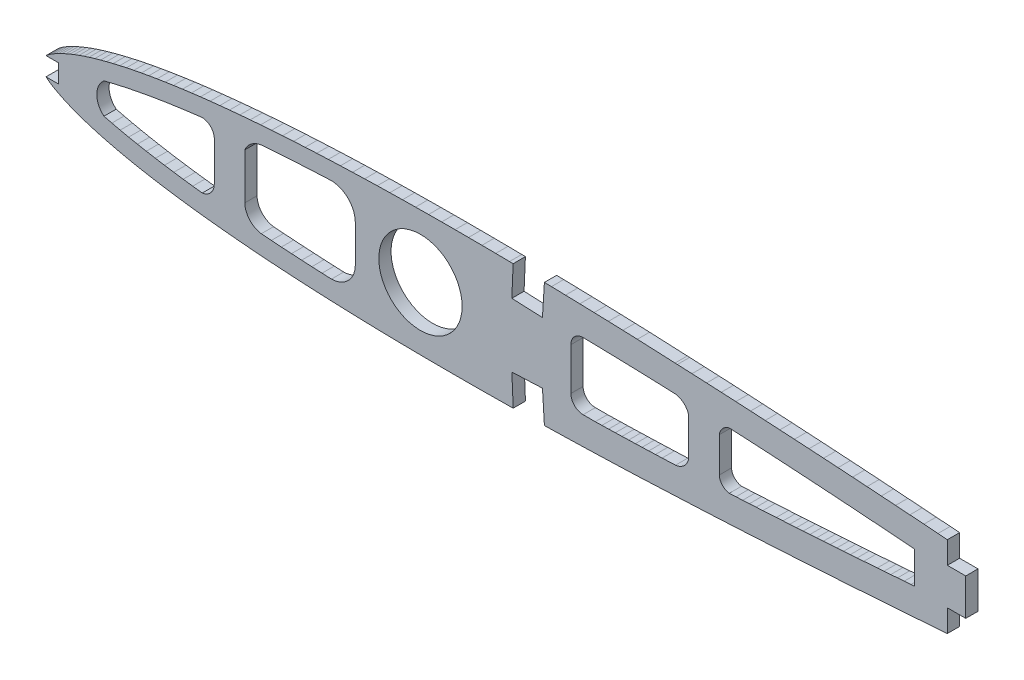
from build123d import *

# Parameters (mm, degrees)
MODEL_R         = 6.794297368
EXTRUDE_1_DEPTH = 2


with BuildPart() as part:
    # Model → 凸台-拉伸1 (new body)
    with BuildSketch(Plane.XY):
        Polygon((-3.904928875, 19.257136271), (-1.898266713, 19.257136271), (-1.898266713, 22.257136271), (-3.904609086, 22.257136271), (-3.641266713, 22.474136271), (-3.265266713, 22.748136271), (-2.876266713, 23.003136271), (-2.365266713, 23.302136271), (-1.843266713, 23.579136271), (-1.312266713, 23.838136271), (-0.652266713, 24.141136271), (0.013733287, 24.427136271), (0.687733287, 24.696136271), (1.489733287, 24.995136271), (2.299733287, 25.274136271), (3.115733287, 25.536136271), (4.060733287, 25.820136271), (5.010733287, 26.086136271), (5.964733287, 26.338136271), (7.045733287, 26.606136271), (8.130733287, 26.859136271), (9.219733287, 27.098136271), (10.433733287, 27.348136271), (11.649733287, 27.582136271), (12.869733287, 27.803136271), (14.210733287, 28.032136271), (15.552733287, 28.247136271), (16.898733287, 28.449136271), (18.361733287, 28.655136271), (19.825733287, 28.848136271), (21.292733287, 29.029136271), (22.872733287, 29.210136271), (24.452733287, 29.380136271), (26.035733287, 29.538136271), (27.724733287, 29.695136271), (29.413733287, 29.841136271), (31.104733287, 29.976136271), (32.896733287, 30.108136271), (34.689733287, 30.229136271), (36.482733287, 30.339136271), (38.370733287, 30.444136271), (40.258733287, 30.539136271), (42.148733287, 30.624136271), (44.124733287, 30.704136271), (46.101733287, 30.774136271), (48.078733287, 30.834136271), (50.135733287, 30.888136271), (52.191733287, 30.933136271), (54.248733287, 30.969136271), (56.378733287, 30.997136271), (58.507733287, 31.017136271), (60.637733287, 31.028136271), (62.831733287, 31.032136271), (65.024733287, 31.028136271), (67.217733287, 31.017136271), (69.466733287, 30.998136271), (71.714733287, 30.971136271), (72.306854961, 30.962184676), (72.087733287, 25.959136271), (77.083733287, 25.741136271), (77.405733287, 30.870636271), (78.552733287, 30.846136271), (80.847733287, 30.791136271), (83.180733287, 30.729136271), (85.512733287, 30.660136271), (87.845733287, 30.586136271), (90.206733287, 30.504136271), (92.566733287, 30.416136271), (98.716780529, 30.134573654), (99.098691617, 30.117885102), (101.478691617, 30.007885102), (103.867691617, 29.892885102), (106.255691617, 29.771885102), (108.643691617, 29.644885102), (111.032691617, 29.512885102), (113.420691617, 29.375885102), (115.808691617, 29.236885102), (118.189691617, 29.095885102), (120.568691617, 28.951885102), (122.948691617, 28.802885102), (125.309691617, 28.650885102), (127.668691617, 28.493885102), (130.029691617, 28.332885102), (132.362691617, 28.170885102), (134.694691617, 28.006885102), (137.027691617, 27.839885102), (139.322691617, 27.671885102), (141.617691617, 27.500885102), (143.143747168, 27.384468484), (143.143747168, 23.764986482), (146.143747168, 23.764986482), (146.143747168, 17.764986482), (143.143747168, 17.764986482), (143.143747168, 14.124636482), (141.617691617, 14.008885102), (139.322691617, 13.837885102), (137.027691617, 13.669885102), (134.694691617, 13.501885102), (132.362691617, 13.337885102), (130.029691617, 13.175885102), (127.668691617, 13.015885102), (125.309691617, 12.858885102), (122.948691617, 12.705885102), (120.568691617, 12.557885102), (118.189691617, 12.413885102), (115.808691617, 12.272885102), (113.420691617, 12.132885102), (111.032691617, 11.995885102), (108.643691617, 11.863885102), (106.255691617, 11.736885102), (103.867691617, 11.615885102), (101.478691617, 11.500885102), (99.098691617, 11.391885102), (98.716930448, 11.375042697), (92.566733287, 11.097136271), (90.206733287, 11.010136271), (87.845733287, 10.928136271), (85.512733287, 10.853136271), (83.180733287, 10.785136271), (80.847733287, 10.722136271), (78.552733287, 10.667136271), (77.405733287, 10.642636271), (77.093361812, 15.763094608), (72.098361812, 15.545094608), (72.316268626, 10.55123018), (71.714733287, 10.542136271), (69.466733287, 10.516136271), (67.217733287, 10.496136271), (65.024733287, 10.485136271), (62.831733287, 10.481136271), (60.637733287, 10.485136271), (58.507733287, 10.497136271), (56.378733287, 10.516136271), (54.248733287, 10.544136271), (52.191733287, 10.580136271), (50.135733287, 10.625136271), (48.078733287, 10.679136271), (46.101733287, 10.740136271), (44.124733287, 10.810136271), (42.148733287, 10.889136271), (40.258733287, 10.974136271), (38.370733287, 11.069136271), (36.482733287, 11.174136271), (34.689733287, 11.285136271), (32.896733287, 11.405136271), (31.104733287, 11.537136271), (29.413733287, 11.672136271), (27.724733287, 11.818136271), (26.035733287, 11.976136271), (24.452733287, 12.134136271), (22.872733287, 12.303136271), (21.292733287, 12.485136271), (19.825733287, 12.665136271), (18.361733287, 12.858136271), (16.898733287, 13.064136271), (15.552733287, 13.267136271), (14.210733287, 13.482136271), (12.869733287, 13.710136271), (11.649733287, 13.931136271), (10.433733287, 14.166136271), (9.219733287, 14.416136271), (8.130733287, 14.654136271), (7.045733287, 14.907136271), (5.964733287, 15.176136271), (5.010733287, 15.427136271), (4.060733287, 15.693136271), (3.115733287, 15.977136271), (2.299733287, 16.239136271), (1.489733287, 16.518136271), (0.687733287, 16.817136271), (0.013733287, 17.087136271), (-0.652266713, 17.373136271), (-1.312266713, 17.675136271), (-1.843266713, 17.935136271), (-2.365266713, 18.211136271), (-2.876266713, 18.511136271), (-3.265266713, 18.765136271), (-3.641266713, 19.039136271), align=None)
        with Locations((57.184251323, 20.757136271)):
            Circle(MODEL_R, mode=Mode.SUBTRACT)
        with BuildLine():
            Line((5.548721123, 23.412080622), (6.840615117, 23.735054121))
            Line((6.840615117, 23.735054121), (8.203563977, 24.049919528))
            Line((8.203563977, 24.049919528), (9.580468827, 24.347029431))
            Line((9.580468827, 24.347029431), (11.008725704, 24.632680807))
            Line((11.008725704, 24.632680807), (12.454759931, 24.902967578))
            Line((12.454759931, 24.902967578), (13.934870343, 25.162438153))
            Line((13.934870343, 25.162438153), (15.419157195, 25.403803948))
            Line((15.419157195, 25.403803948), (16.940964656, 25.633553655))
            Line((16.940964656, 25.633553655), (18.472927795, 25.850772309))
            Line((18.472927795, 25.850772309), (20.02662113, 26.056711042))
            Line((20.02662113, 26.056711042), (21.584312521, 26.249131744))
            ThreePointArc((21.584312521, 26.249131744), (23.008577337, 25.607158467), (23.548379113, 24.141118223))
            Line((23.548379113, 24.141118223), (23.548379113, 17.882100159))
            ThreePointArc((23.548379113, 17.882100159), (23.001354723, 16.360643911), (21.584312521, 15.582147797))
            Line((21.584312521, 15.582147797), (20.02662113, 15.774568498))
            Line((20.02662113, 15.774568498), (18.472927795, 15.980507232))
            Line((18.472927795, 15.980507232), (16.940964656, 16.197725886))
            Line((16.940964656, 16.197725886), (15.419157195, 16.427475592))
            Line((15.419157195, 16.427475592), (13.934870343, 16.668841388))
            Line((13.934870343, 16.668841388), (12.454759931, 16.928311963))
            Line((12.454759931, 16.928311963), (11.008725704, 17.198598734))
            Line((11.008725704, 17.198598734), (9.580468827, 17.48425011))
            Line((9.580468827, 17.48425011), (8.203563977, 17.781360013))
            Line((8.203563977, 17.781360013), (6.840615117, 18.09622542))
            Line((6.840615117, 18.09622542), (5.548721123, 18.419198918))
            ThreePointArc((5.548721123, 18.419198918), (4.383350459, 20.91563977), (5.548721123, 23.412080622))
        make_face(mode=Mode.SUBTRACT)
        with BuildLine():
            Line((31.213289067, 27.184719881), (32.854840919, 27.308127325))
            Line((32.854840919, 27.308127325), (34.491785611, 27.421900786))
            Line((34.491785611, 27.421900786), (36.14288999, 27.526695845))
            Line((36.14288999, 27.526695845), (37.80205053, 27.62484337))
            Line((37.80205053, 27.62484337), (39.461205149, 27.715724031))
            Line((39.461205149, 27.715724031), (41.127710475, 27.797530042))
            Line((41.127710475, 27.797530042), (42.660857543, 27.868290676))
            ThreePointArc((42.660857543, 27.868290676), (45.419538492, 26.682795274), (46.556398714, 23.903718312))
            Line((46.556398714, 23.903718312), (46.556398714, 17.927561228))
            ThreePointArc((46.556398714, 17.927561228), (45.419538492, 15.148484267), (42.660857543, 13.962988864))
            Line((42.660857543, 13.962988864), (41.127710475, 14.033749498))
            Line((41.127710475, 14.033749498), (39.461205149, 14.11555551))
            Line((39.461205149, 14.11555551), (37.80205053, 14.20643617))
            Line((37.80205053, 14.20643617), (36.14288999, 14.304583695))
            Line((36.14288999, 14.304583695), (34.491785611, 14.409378755))
            Line((34.491785611, 14.409378755), (32.854840919, 14.523152215))
            Line((32.854840919, 14.523152215), (31.213289067, 14.64655966))
            ThreePointArc((31.213289067, 14.64655966), (29.313385312, 15.66170282), (28.524280387, 17.666063899))
            Line((28.524280387, 17.666063899), (28.524280387, 25.153588954))
            ThreePointArc((28.524280387, 25.153588954), (29.602139204, 26.522165697), (31.213289067, 27.184719881))
        make_face(mode=Mode.SUBTRACT)
        with BuildLine():
            Line((137.761539545, 23.390840064), (137.209687212, 23.434028501))
            Line((137.209687212, 23.434028501), (136.112253522, 23.518812167))
            Line((136.112253522, 23.518812167), (135.013229103, 23.602524582))
            Line((135.013229103, 23.602524582), (133.910429103, 23.685324582))
            Line((133.910429103, 23.685324582), (132.809517357, 23.769180754))
            Line((132.809517357, 23.769180754), (131.712383033, 23.850361531))
            Line((131.712383033, 23.850361531), (130.611472045, 23.930623812))
            Line((130.611472045, 23.930623812), (129.510425513, 24.010895975))
            Line((129.510425513, 24.010895975), (128.412604702, 24.089824268))
            Line((128.412604702, 24.089824268), (127.311830464, 24.167680988))
            Line((127.311830464, 24.167680988), (126.213747532, 24.245431948))
            Line((126.213747532, 24.245431948), (125.115932824, 24.320772173))
            Line((125.115932824, 24.320772173), (124.015155669, 24.396233492))
            Line((124.015155669, 24.396233492), (122.91721259, 24.47038651))
            Line((122.91721259, 24.47038651), (121.819400112, 24.543334834))
            Line((121.819400112, 24.543334834), (120.721466559, 24.615095197))
            Line((120.721466559, 24.615095197), (119.624855675, 24.685651404))
            Line((119.624855675, 24.685651404), (118.527167499, 24.755004252))
            Line((118.527167499, 24.755004252), (117.427462718, 24.823286575))
            Line((117.427462718, 24.823286575), (116.330736089, 24.891458233))
            Line((116.330736089, 24.891458233), (115.234830171, 24.957117084))
            Line((115.234830171, 24.957117084), (114.136214831, 25.02181199))
            Line((114.136214831, 25.02181199), (113.039612338, 25.086388363))
            Line((113.039612338, 25.086388363), (111.944909668, 25.148465287))
            Line((111.944909668, 25.148465287), (110.84830882, 25.209453993))
            Line((110.84830882, 25.209453993), (109.751708655, 25.269246804))
            Line((109.751708655, 25.269246804), (108.657009738, 25.327742166))
            Line((108.657009738, 25.327742166), (107.560411113, 25.38394733))
            ThreePointArc((107.560411113, 25.38394733), (106.472715189, 24.74418894), (105.930681987, 23.604639366))
            Line((105.930681987, 23.604639366), (105.930681987, 17.91620302))
            ThreePointArc((105.930681987, 17.91620302), (106.428971857, 16.739638765), (107.560411113, 16.14597097))
            Line((107.560411113, 16.14597097), (108.657009738, 16.202176134))
            Line((108.657009738, 16.202176134), (109.751708655, 16.260671496))
            Line((109.751708655, 16.260671496), (110.84830882, 16.320464308))
            Line((110.84830882, 16.320464308), (111.944909668, 16.381453014))
            Line((111.944909668, 16.381453014), (113.039612338, 16.443529937))
            Line((113.039612338, 16.443529937), (114.136214831, 16.508106311))
            Line((114.136214831, 16.508106311), (115.234830171, 16.572801216))
            Line((115.234830171, 16.572801216), (116.330736089, 16.638460067))
            Line((116.330736089, 16.638460067), (117.427462718, 16.706631726))
            Line((117.427462718, 16.706631726), (118.527167499, 16.774914049))
            Line((118.527167499, 16.774914049), (119.624855675, 16.844266896))
            Line((119.624855675, 16.844266896), (120.721466559, 16.914823104))
            Line((120.721466559, 16.914823104), (121.819400112, 16.986583467))
            Line((121.819400112, 16.986583467), (122.91721259, 17.05953179))
            Line((122.91721259, 17.05953179), (124.015155669, 17.133684809))
            Line((124.015155669, 17.133684809), (125.115932824, 17.209146127))
            Line((125.115932824, 17.209146127), (126.213747532, 17.284486353))
            Line((126.213747532, 17.284486353), (127.311830464, 17.362237312))
            Line((127.311830464, 17.362237312), (128.412604702, 17.440094032))
            Line((128.412604702, 17.440094032), (129.510425513, 17.519022326))
            Line((129.510425513, 17.519022326), (130.611472045, 17.599294489))
            Line((130.611472045, 17.599294489), (131.712383033, 17.679556769))
            Line((131.712383033, 17.679556769), (132.809517357, 17.760737546))
            Line((132.809517357, 17.760737546), (133.910429103, 17.844593719))
            Line((133.910429103, 17.844593719), (135.013229103, 17.927393719))
            Line((135.013229103, 17.927393719), (136.112253522, 18.011106134))
            Line((136.112253522, 18.011106134), (137.209687212, 18.095889799))
            Line((137.209687212, 18.095889799), (137.761539545, 18.139078236))
            Line((137.761539545, 18.139078236), (137.761539545, 23.390840064))
        make_face(mode=Mode.SUBTRACT)
        with BuildLine():
            Line((98.80110491, 25.787810953), (96.613362617, 25.873841175))
            Line((96.613362617, 25.873841175), (95.519888695, 25.914428635))
            Line((95.519888695, 25.914428635), (94.427544816, 25.952630826))
            Line((94.427544816, 25.952630826), (93.335272863, 25.989636761))
            Line((93.335272863, 25.989636761), (92.24300173, 26.02425519))
            Line((92.24300173, 26.02425519), (91.148821499, 26.057738301))
            Line((91.148821499, 26.057738301), (90.058412103, 26.089914316))
            Line((90.058412103, 26.089914316), (88.969205947, 26.118514915))
            Line((88.969205947, 26.118514915), (87.876185538, 26.146019805))
            Line((87.876185538, 26.146019805), (86.786324675, 26.172281513))
            Line((86.786324675, 26.172281513), (85.697186186, 26.196113865))
            Line((85.697186186, 26.196113865), (84.609206827, 26.217563622))
            Line((84.609206827, 26.217563622), (83.757905029, 26.232482383))
            ThreePointArc((83.757905029, 26.232482383), (82.321092207, 25.659339076), (81.722861122, 24.232789425))
            Line((81.722861122, 24.232789425), (81.722861122, 17.333818395))
            ThreePointArc((81.722861122, 17.333818395), (82.30864756, 15.919604833), (83.722861122, 15.333818395))
            Line((83.722861122, 15.333818395), (85.697824132, 15.333818395))
            Line((85.697824132, 15.333818395), (86.786324675, 15.357636788))
            Line((86.786324675, 15.357636788), (87.876185538, 15.383898496))
            Line((87.876185538, 15.383898496), (88.969205947, 15.411403386))
            Line((88.969205947, 15.411403386), (90.058412103, 15.440003985))
            Line((90.058412103, 15.440003985), (91.148821499, 15.47218))
            Line((91.148821499, 15.47218), (92.24300173, 15.505663111))
            Line((92.24300173, 15.505663111), (93.335272863, 15.54028154))
            Line((93.335272863, 15.54028154), (94.427544816, 15.577287475))
            Line((94.427544816, 15.577287475), (95.519888695, 15.615489665))
            Line((95.519888695, 15.615489665), (96.613362617, 15.656077125))
            Line((96.613362617, 15.656077125), (98.80110491, 15.742107347))
            ThreePointArc((98.80110491, 15.742107347), (100.194838811, 16.369922051), (100.936057497, 17.706799139))
            Line((100.936057497, 17.706799139), (100.936057497, 23.888675864))
            ThreePointArc((100.936057497, 23.888675864), (100.158256017, 25.163887433), (98.80110491, 25.787810953))
        make_face(mode=Mode.SUBTRACT)
    extrude(amount=EXTRUDE_1_DEPTH)


solid = part.part
